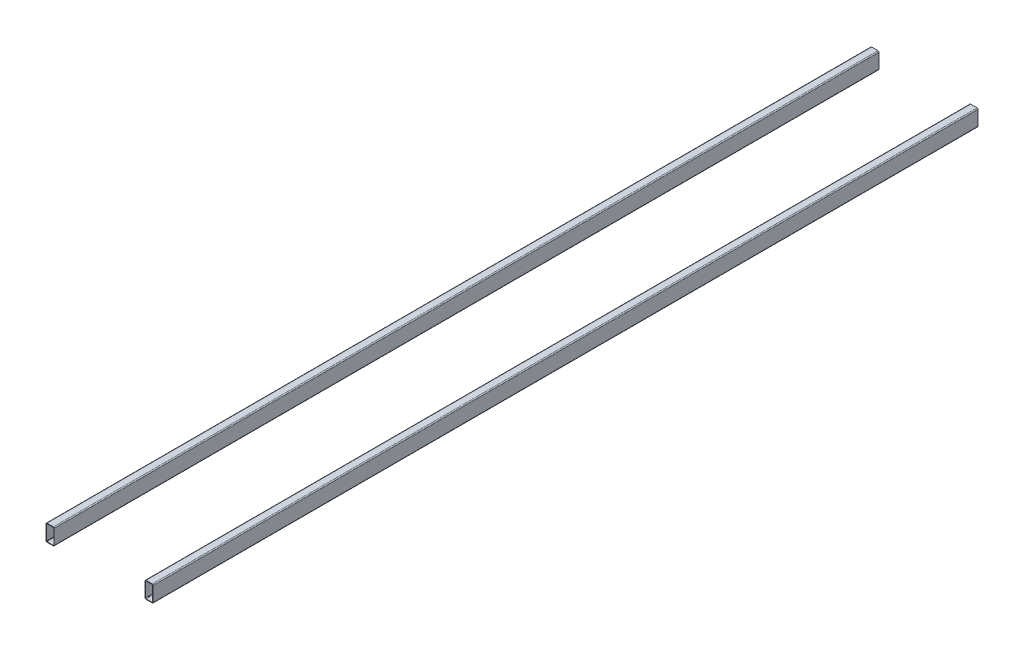
from build123d import *

# Parameters (mm, degrees)
TWO_RAILS_PROTOTYPE_DEPTH   = 5000
TWO_RAILS_PROTOTYPE_2_DEPTH = 5000


with BuildPart() as part:
    # PROFILE_100_50_3_R6_FIXED → TWO_RAILS_PROTOTYPE (new body)
    with BuildSketch(Plane.XY):
        with BuildLine():
            Line((-319, -50), (-281, -50))
            ThreePointArc((-281, -50), (-276.757359313, -48.242640687), (-275, -44))
            Line((-275, -44), (-275, 44))
            ThreePointArc((-275, 44), (-276.757359313, 48.242640687), (-281, 50))
            Line((-281, 50), (-319, 50))
            ThreePointArc((-319, 50), (-323.242640687, 48.242640687), (-325, 44))
            Line((-325, 44), (-325, -44))
            ThreePointArc((-325, -44), (-323.242640687, -48.242640687), (-319, -50))
        make_face()
        with BuildLine():
            Line((-319, -47), (-281, -47))
            ThreePointArc((-281, -47), (-278.878679656, -46.121320344), (-278, -44))
            Line((-278, -44), (-278, 44))
            ThreePointArc((-278, 44), (-278.878679656, 46.121320344), (-281, 47))
            Line((-281, 47), (-319, 47))
            ThreePointArc((-319, 47), (-321.121320344, 46.121320344), (-322, 44))
            Line((-322, 44), (-322, -44))
            ThreePointArc((-322, -44), (-321.121320344, -46.121320344), (-319, -47))
        make_face(mode=Mode.SUBTRACT)
    extrude(amount=TWO_RAILS_PROTOTYPE_DEPTH)


with BuildPart() as body_2:
    # PROFILE_100_50_3_R6_FIXED → TWO_RAILS_PROTOTYPE 2 (new body)
    with BuildSketch(Plane.XY):
        with BuildLine():
            Line((281, -50), (319, -50))
            ThreePointArc((319, -50), (323.242640687, -48.242640687), (325, -44))
            Line((325, -44), (325, 44))
            ThreePointArc((325, 44), (323.242640687, 48.242640687), (319, 50))
            Line((319, 50), (281, 50))
            ThreePointArc((281, 50), (276.757359313, 48.242640687), (275, 44))
            Line((275, 44), (275, -44))
            ThreePointArc((275, -44), (276.757359313, -48.242640687), (281, -50))
        make_face()
        with BuildLine():
            Line((281, -47), (319, -47))
            ThreePointArc((319, -47), (321.121320344, -46.121320344), (322, -44))
            Line((322, -44), (322, 44))
            ThreePointArc((322, 44), (321.121320344, 46.121320344), (319, 47))
            Line((319, 47), (281, 47))
            ThreePointArc((281, 47), (278.878679656, 46.121320344), (278, 44))
            Line((278, 44), (278, -44))
            ThreePointArc((278, -44), (278.878679656, -46.121320344), (281, -47))
        make_face(mode=Mode.SUBTRACT)
    extrude(amount=TWO_RAILS_PROTOTYPE_2_DEPTH)


solid = Compound([part.part, body_2.part])
